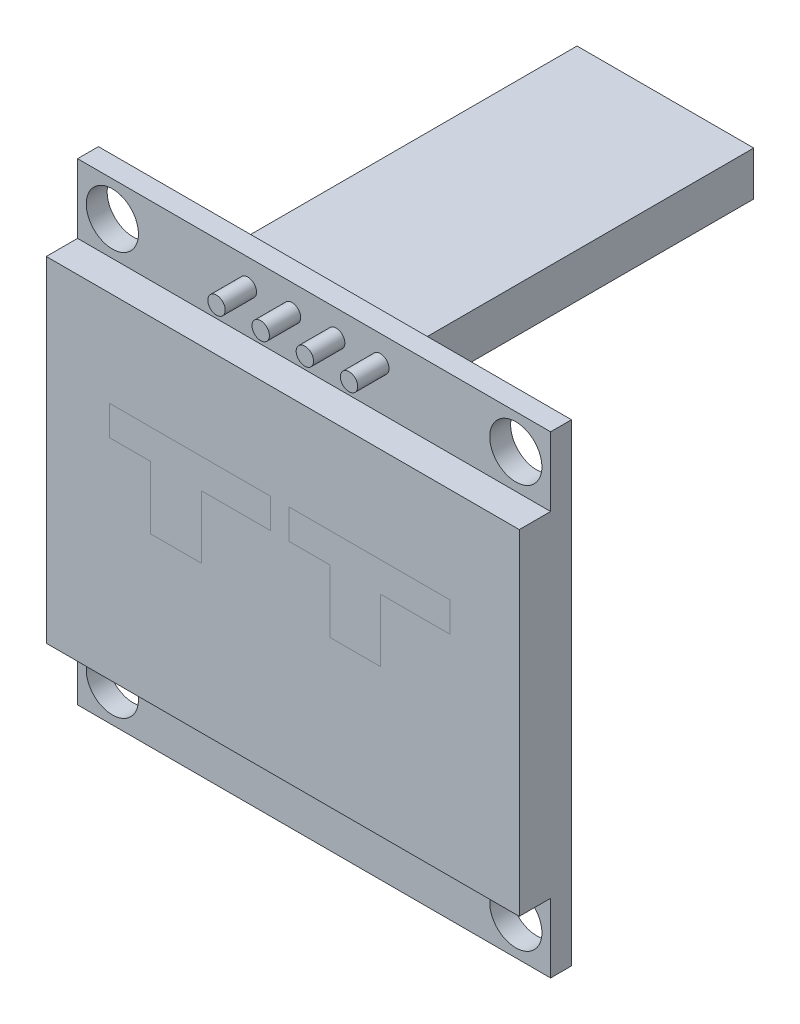
from build123d import *

# Parameters (mm, degrees)
SKETCH_1_W                    = 27.2
SKETCH_1_H                    = 27.2
EXTRUDE_480_DEPTH             = 1.2
SKETCH_2_W                    = 27.2
SKETCH_2_H                    = 19.26
EXTRUDE_643_DEPTH             = 1.8
EXTRUDE_867_REACH             = 21.317
SKETCH_3_R                    = 0.5
EXTRUDE_867_DIRECTION_2_DEPTH = 9.2
SKETCH_4_R                    = 1.5
CUT_EXTRUDE_1140_DEPTH        = 22.320412754
SKETCH_5_W                    = 10.16
SKETCH_5_H                    = 2.54
EXTRUDE_1389_DEPTH            = 2
SKETCH_7_W                    = 10.16
SKETCH_7_H                    = 2.54
EXTRUDE_2113_DEPTH            = 17


with BuildPart() as part:
    # Эскиз1 → Extrude 480 (new body)
    with BuildSketch(Plane.XY):
        Rectangle(SKETCH_1_W, SKETCH_1_H)
    extrude(amount=EXTRUDE_480_DEPTH)

    # Эскиз2 → Extrude 643 (add)
    with BuildSketch(Plane.XY.offset(1.2)):
        Rectangle(SKETCH_2_W, SKETCH_2_H)
    extrude(amount=EXTRUDE_643_DEPTH)

    # Extrude 867: up to this face of the body (flat: up to its plane)
    extrude_867_end = Plane(part.part.faces().sort_by_distance((0, 0, 3))[0])
    # Эскиз3 → Extrude 867 (add, up to the picked face)
    with BuildSketch(Plane.XY.offset(1.2), mode=Mode.PRIVATE) as extrude_867_sk1:
        with Locations((-3.81, 12.1)):
            Circle(SKETCH_3_R)
    extrude_867_tool1 = split(extrude(extrude_867_sk1.sketch, amount=EXTRUDE_867_REACH, mode=Mode.PRIVATE), bisect_by=extrude_867_end, keep=Keep.BOTH, mode=Mode.PRIVATE)
    # Эскиз3 → Extrude 867 (add, up to the picked face)
    with BuildSketch(Plane.XY.offset(1.2), mode=Mode.PRIVATE) as extrude_867_sk2:
        with Locations((-1.27, 12.1)):
            Circle(SKETCH_3_R)
    extrude_867_tool2 = split(extrude(extrude_867_sk2.sketch, amount=EXTRUDE_867_REACH, mode=Mode.PRIVATE), bisect_by=extrude_867_end, keep=Keep.BOTH, mode=Mode.PRIVATE)
    # Эскиз3 → Extrude 867 (add, up to the picked face)
    with BuildSketch(Plane.XY.offset(1.2), mode=Mode.PRIVATE) as extrude_867_sk3:
        with Locations((1.27, 12.1)):
            Circle(SKETCH_3_R)
    extrude_867_tool3 = split(extrude(extrude_867_sk3.sketch, amount=EXTRUDE_867_REACH, mode=Mode.PRIVATE), bisect_by=extrude_867_end, keep=Keep.BOTH, mode=Mode.PRIVATE)
    # Эскиз3 → Extrude 867 (add, up to the picked face)
    with BuildSketch(Plane.XY.offset(1.2), mode=Mode.PRIVATE) as extrude_867_sk4:
        with Locations((3.81, 12.1)):
            Circle(SKETCH_3_R)
    extrude_867_tool4 = split(extrude(extrude_867_sk4.sketch, amount=EXTRUDE_867_REACH, mode=Mode.PRIVATE), bisect_by=extrude_867_end, keep=Keep.BOTH, mode=Mode.PRIVATE)
    add(extrude_867_tool1.solids().sort_by(Axis((-3.81, 12.1, 1.2), (0, 0, 1)))[0])
    add(extrude_867_tool2.solids().sort_by(Axis((-1.27, 12.1, 1.2), (0, 0, 1)))[0])
    add(extrude_867_tool3.solids().sort_by(Axis((1.27, 12.1, 1.2), (0, 0, 1)))[0])
    add(extrude_867_tool4.solids().sort_by(Axis((3.81, 12.1, 1.2), (0, 0, 1)))[0])

    # Эскиз3 → Extrude 867 direction 2 (add)
    with BuildSketch(Plane.XY.offset(1.2)):
        with Locations((-3.81, 12.1)):
            Circle(SKETCH_3_R)
        with Locations((-1.27, 12.1)):
            Circle(SKETCH_3_R)
        with Locations((1.27, 12.1)):
            Circle(SKETCH_3_R)
        with Locations((3.81, 12.1)):
            Circle(SKETCH_3_R)
    extrude(amount=-EXTRUDE_867_DIRECTION_2_DEPTH)

    # Эскиз4 → Cut-Extrude 1140 (cut, through all)
    with BuildSketch(Plane.XY.offset(1.2)):
        with Locations((-11.6, 11.6)):
            Circle(SKETCH_4_R)
        with Locations((11.6, 11.6)):
            Circle(SKETCH_4_R)
        with Locations((11.6, -11.6)):
            Circle(SKETCH_4_R)
        with Locations((-11.6, -11.6)):
            Circle(SKETCH_4_R)
    extrude(amount=-CUT_EXTRUDE_1140_DEPTH, mode=Mode.SUBTRACT)

    # Эскиз5 → Extrude 1389 (add)
    with BuildSketch(Plane(origin=(0, 0, 0), x_dir=(-1, 0, 0), z_dir=(0, 0, -1))):
        with Locations((0, 12.1)):
            Rectangle(SKETCH_5_W, SKETCH_5_H)
    extrude(amount=EXTRUDE_1389_DEPTH)

    # Эскиз7 → Extrude 2113 (add)
    with BuildSketch(Plane(origin=(0, 0, -2), x_dir=(-1, 0, 0), z_dir=(0, 0, -1))):
        with Locations((0, 12.1)):
            Rectangle(SKETCH_7_W, SKETCH_7_H)
    extrude(amount=EXTRUDE_2113_DEPTH)


solid = part.part
